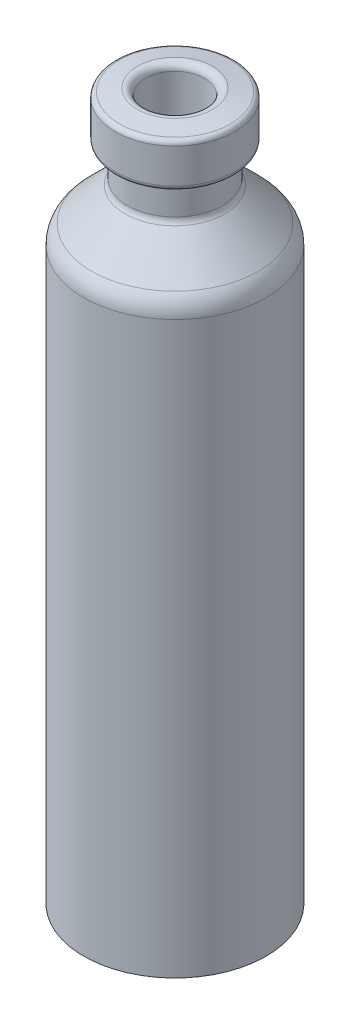
from build123d import *


with BuildPart() as part:
    # Sketch1 → Revolve1 (revolve)
    with BuildSketch(Plane(origin=(0, 0, 0), x_dir=(0, 0, -1), z_dir=(1, 0, 0))):
        with BuildLine():
            Line((0, 0), (0, 34.232769388))
            ThreePointArc((0, 34.232769388), (-0.123261782, 34.848597478), (-0.474055296, 35.369540484))
            Line((-0.474055296, 35.369540484), (-2.47685772, 37.353268599))
            ThreePointArc((-2.47685772, 37.353268599), (-2.586480693, 37.516063288), (-2.625, 37.708509566))
            Line((-2.625, 37.708509566), (-2.625, 39.175538739))
            ThreePointArc((-2.625, 39.175538739), (-2.563006002, 39.358167168), (-2.402645714, 39.465316487))
            Line((-2.402645714, 39.465316487), (-2.122354286, 39.540420349))
            ThreePointArc((-2.122354286, 39.540420349), (-1.961993998, 39.647569668), (-1.9, 39.830198096))
            Line((-1.9, 39.830198096), (-1.9, 41.902814528))
            ThreePointArc((-1.9, 41.902814528), (-1.968512625, 42.093637994), (-2.142757301, 42.197302683))
            Line((-2.142757301, 42.197302683), (-3.223676402, 42.407412072))
            ThreePointArc((-3.223676402, 42.407412072), (-3.554431288, 42.323411032), (-3.7, 42.014761198))
            Line((-3.7, 42.014761198), (-3.7, 37.365776148))
            ThreePointArc((-3.7, 37.365776148), (-3.661480693, 37.17332987), (-3.55185772, 37.010535181))
            Line((-3.55185772, 37.010535181), (-1.324055296, 34.803949923))
            ThreePointArc((-1.324055296, 34.803949923), (-0.973261782, 34.283006917), (-0.85, 33.667178827))
            Line((-0.85, 33.667178827), (-0.85, 0))
            Line((-0.85, 0), (0, 0))
        make_face()
    revolve(axis=Axis((0, 0, 5.475), (0, 1, 0)))


solid = part.part
